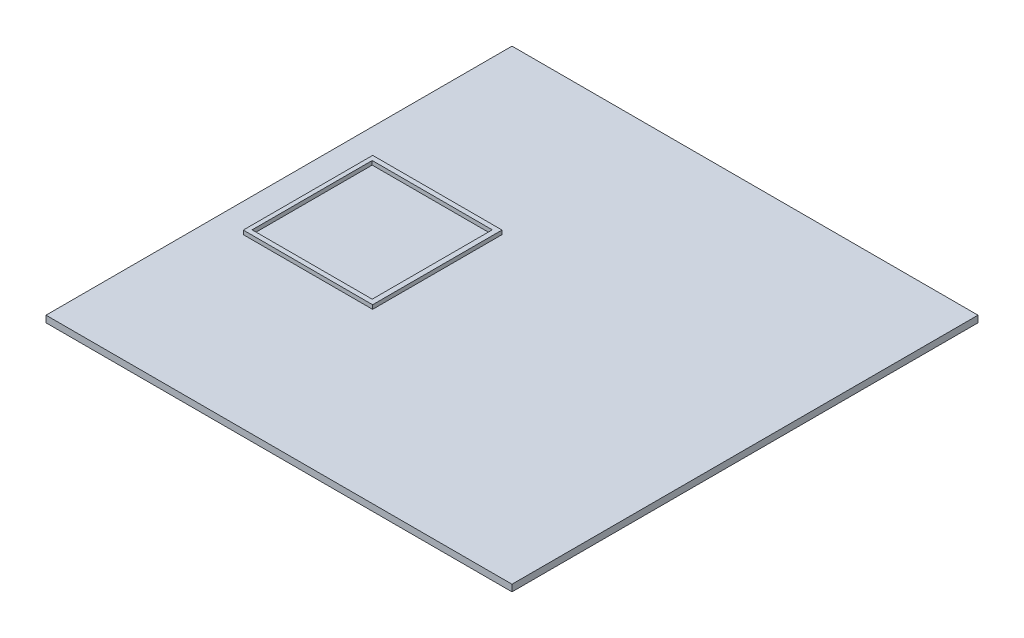
from build123d import *

# Parameters (mm, degrees)
SKETCH2_W           = 350
SKETCH2_H           = 350
BOSS_EXTRUDE1_DEPTH = 5
SKETCH4_W           = 90.2
SKETCH4_H           = 90.2
BOSS_EXTRUDE2_DEPTH = 3


with BuildPart() as part:
    # Sketch2 → Boss-Extrude1 (new body)
    with BuildSketch(Plane(origin=(0, 0, 0), x_dir=(1, 0, 0), z_dir=(0, 1, 0))):
        Rectangle(SKETCH2_W, SKETCH2_H)
    extrude(amount=BOSS_EXTRUDE1_DEPTH)

    # Sketch4 → Boss-Extrude2 (add)
    with BuildSketch(Plane(origin=(0, 5, 0), x_dir=(1, 0, 0), z_dir=(0, 1, 0))):
        Polygon((-56.121208512, 45.1), (-56.121208512, 48.622803372), (-59.9, 48.622803372), (-150.1, 48.622803372), (-153.264875212, 48.622803372), (-153.264875212, 45.1), (-153.264875212, -45.1), (-153.264875212, -48.557517283), (-150.1, -48.557517283), (-59.9, -48.557517283), (-56.121208512, -48.557517283), (-56.121208512, -45.1), align=None)
        with Locations((-105, 0)):
            Rectangle(SKETCH4_W, SKETCH4_H, mode=Mode.SUBTRACT)
    extrude(amount=BOSS_EXTRUDE2_DEPTH)


solid = part.part
